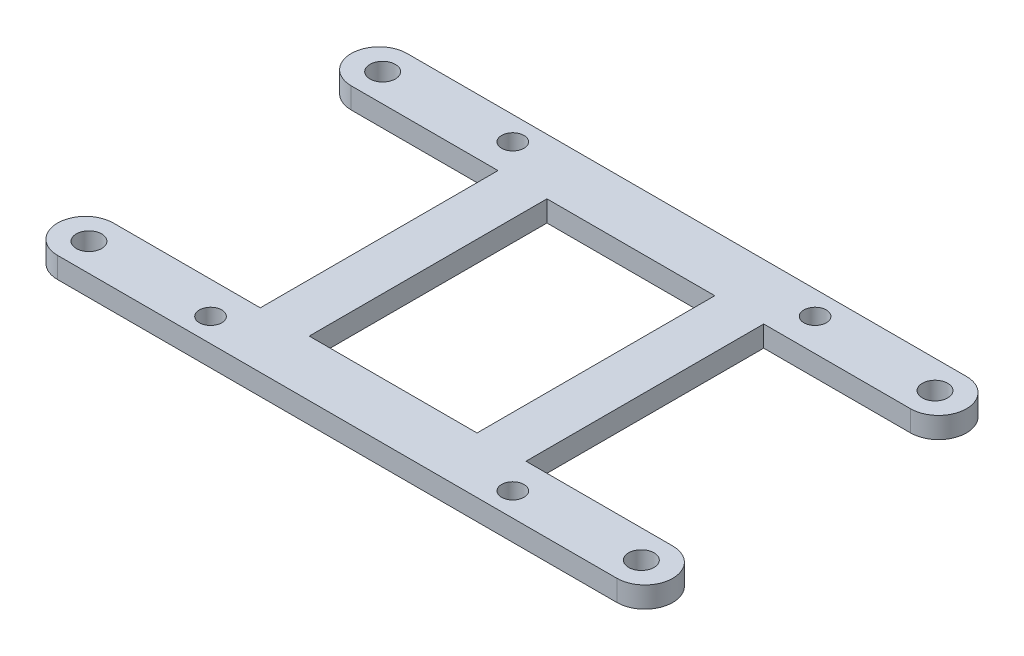
from build123d import *

# Parameters (mm, degrees)
SKETCH_1_R      = 1.6
SKETCH_1_R_2    = 1.817226884
SKETCH_1_W      = 24
SKETCH_1_H      = 34
EXTRUDE_1_DEPTH = 3


with BuildPart() as part:
    # 草图1 → 凸台-拉伸1 (new body)
    # profile 1 of 3: a face of its own
    with BuildSketch(Plane(origin=(0, 0, 0), x_dir=(1, 0, 0), z_dir=(0, 1, 0))):
        with BuildLine():
            Line((19, -17), (19, 17))
            Line((19, 17), (40, 17))
            ThreePointArc((40, 17), (42.828427126, 18.171572876), (44, 21.000000002))
            ThreePointArc((44, 21.000000002), (42.828427124, 23.828427126), (40, 25))
            Line((40, 25), (19, 25))
            Line((19, 25), (-19, 25))
            Line((-19, 25), (-19, 17))
            Line((-19, 17), (-19, -17))
            Line((-19, -17), (-19, -25))
            Line((-19, -25), (19, -25))
            Line((19, -25), (40, -25))
            ThreePointArc((40, -25), (42.828427125, -23.828427125), (44, -21))
            ThreePointArc((44, -21), (42.828427125, -18.171572875), (40, -17))
            Line((40, -17), (19, -17))
        make_face()
        with Locations(Location((21.73, -21.615, 0), (0, 0, 270))):
            Circle(SKETCH_1_R, mode=Mode.SUBTRACT)
        with Locations(Location((39.5, -21, 0), (0, 0, 270))):
            Circle(SKETCH_1_R_2, mode=Mode.SUBTRACT)
        Rectangle(SKETCH_1_W, SKETCH_1_H, mode=Mode.SUBTRACT)
        with Locations(Location((21.73, 21.615, 0), (0, 0, 270))):
            Circle(SKETCH_1_R, mode=Mode.SUBTRACT)
        with Locations(Location((39.5, 21, 0), (0, 0, 270))):
            Circle(SKETCH_1_R_2, mode=Mode.SUBTRACT)
    # profile 2 of 3: a face of its own
    with BuildSketch(Plane(origin=(0, 0, 0), x_dir=(1, 0, 0), z_dir=(0, 1, 0))):
        with BuildLine():
            Line((-19, 17), (-19, 25))
            Line((-19, 25), (-40, 25))
            ThreePointArc((-40, 25), (-44, 21), (-40, 17))
            Line((-40, 17), (-19, 17))
        make_face()
        with Locations(Location((-39.5, 21, 0), (0, 0, 270))):
            Circle(SKETCH_1_R_2, mode=Mode.SUBTRACT)
        with Locations(Location((-21.5, 21.615, 0), (0, 0, 270))):
            Circle(SKETCH_1_R, mode=Mode.SUBTRACT)
    # profile 3 of 3: a face of its own
    with BuildSketch(Plane(origin=(0, 0, 0), x_dir=(1, 0, 0), z_dir=(0, 1, 0))):
        with BuildLine():
            Line((-40, -25), (-19, -25))
            Line((-19, -25), (-19, -17))
            Line((-19, -17), (-40, -17))
            ThreePointArc((-40, -17), (-44, -21), (-40, -25))
        make_face()
        with Locations(Location((-39.5, -21, 0), (0, 0, 270))):
            Circle(SKETCH_1_R_2, mode=Mode.SUBTRACT)
        with Locations(Location((-21.5, -21.615, 0), (0, 0, 270))):
            Circle(SKETCH_1_R, mode=Mode.SUBTRACT)
    extrude(amount=EXTRUDE_1_DEPTH)


solid = part.part
